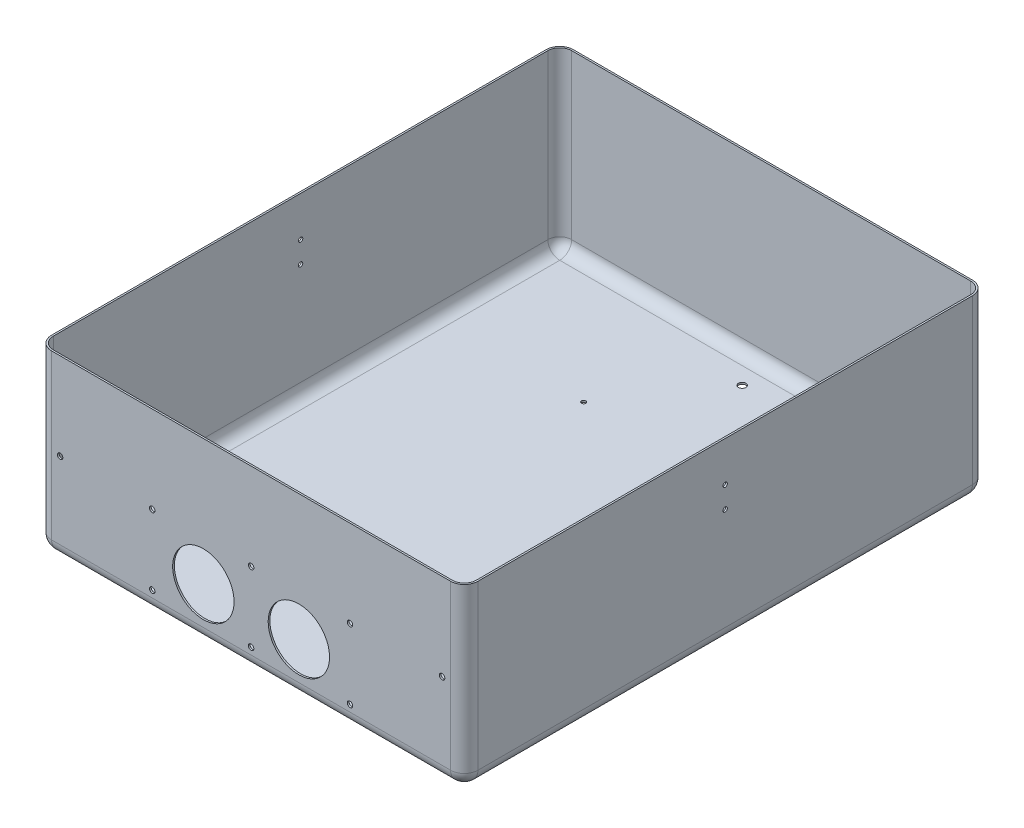
from build123d import *

# Parameters (mm, degrees)
SKETCH1_W          = 396.875
SKETCH1_H          = 485.775
EXTRUDE1_DEPTH     = 165.1
FILLET1_R          = 12.7
FILLET2_R          = 12.7
SHELL1_T           = -1.6002
SKETCH2_R          = 28.575
SKETCH2_R_2        = 2.5527
CUT_EXTRUDE1_DEPTH = 25.4
SKETCH6_R          = 3.4544
CUT_EXTRUDE5_DEPTH = 551.102537743
SKETCH7_R          = 1.9812
CUT_EXTRUDE6_DEPTH = 551.102537743
CUT_EXTRUDE7_REACH = 650.649
SKETCH8_R          = 2.0447


with BuildPart() as part:
    # Sketch1 → Extrude1 (new body)
    with BuildSketch(Plane(origin=(0, 0, 0), x_dir=(1, 0, 0), z_dir=(0, 1, 0))):
        with Locations((0, 242.8875)):
            Rectangle(SKETCH1_W, SKETCH1_H)
    extrude(amount=EXTRUDE1_DEPTH)

    # Fillet1
    fillet1_edges = [part.edges().sort_by_distance(p)[0] for p in [
        (-198.4375, 82.55, -485.775),
        (198.4375, 82.55, -485.775),
        (198.4375, 82.55, 0),
        (-198.4375, 82.55, 0),
    ]]
    fillet(fillet1_edges, radius=FILLET1_R)

    # Fillet2
    fillet2_edges = [part.edges().sort_by_distance(p)[0] for p in [
        (0, 0, 0),
        (-198.4375, 0, -242.8875),
        (0, 0, -485.775),
        (198.4375, 0, -242.8875),
        (194.717756121, 0, -3.719743879),
        (194.717756121, 0, -482.055256121),
        (-194.717756121, 0, -482.055256121),
        (-194.717756121, 0, -3.719743879),
    ]]
    fillet(fillet2_edges, radius=FILLET2_R)

    # Shell1
    shell1_openings = [part.faces().sort_by_distance(p)[0] for p in [
        (0, 165.1, -242.8875),
    ]]
    offset(amount=SHELL1_T, openings=shell1_openings, kind=Kind.INTERSECTION)

    # Sketch2 → Cut-Extrude1 (cut)
    with BuildSketch(Plane.XY):
        with Locations((-44.45, 47.625)):
            Circle(SKETCH2_R)
        with Locations(Location((44.45, 47.625, 0), (0, 0, 180))):
            Circle(SKETCH2_R)
        with Locations((-92.075, 84.1502)):
            Circle(SKETCH2_R_2)
        with Locations((-92.075, 19.05)):
            Circle(SKETCH2_R_2)
        with Locations(Location((92.075, 19.05, 0), (0, 0, 180))):
            Circle(SKETCH2_R_2)
        with Locations(Location((92.075, 84.1502, 0), (0, 0, 180))):
            Circle(SKETCH2_R_2)
        with Locations((0, 84.1502)):
            Circle(SKETCH2_R_2)
        with Locations((0, 19.05)):
            Circle(SKETCH2_R_2)
        with Locations((-177.8, 84.1502)):
            Circle(SKETCH2_R_2)
        with Locations(Location((177.8, 84.1502, 0), (0, 0, 180))):
            Circle(SKETCH2_R_2)
    extrude(amount=-CUT_EXTRUDE1_DEPTH, mode=Mode.SUBTRACT)

    # Sketch6 → Cut-Extrude5 (cut, through all)
    with BuildSketch(Plane(origin=(0, 0, 0), x_dir=(1, 0, 0), z_dir=(0, 1, 0))):
        with Locations(Location((0, 457.2, 0), (0, 0, 270))):
            Circle(SKETCH6_R)
    extrude(amount=CUT_EXTRUDE5_DEPTH, mode=Mode.SUBTRACT)

    # Sketch7 → Cut-Extrude6 (cut, through all)
    with BuildSketch(Plane(origin=(0, 0, 0), x_dir=(1, 0, 0), z_dir=(0, 1, 0))):
        with Locations(Location((-60.325, 103.2002, 0), (0, 0, 270))):
            Circle(SKETCH7_R)
        with Locations(Location((-60.325, 369.8748, 0), (0, 0, 270))):
            Circle(SKETCH7_R)
        with Locations(Location((60.325, 369.8748, 0), (0, 0, 90))):
            Circle(SKETCH7_R)
        with Locations(Location((60.325, 103.2002, 0), (0, 0, 90))):
            Circle(SKETCH7_R)
    extrude(amount=CUT_EXTRUDE6_DEPTH, mode=Mode.SUBTRACT)

    # Sketch8 → Cut-Extrude7 (cut, up to next)
    with BuildSketch(Plane(origin=(198.4375, 0, 0), x_dir=(0, 0, -1), z_dir=(1, 0, 0)), mode=Mode.PRIVATE) as cut_extrude7_sk1:
        with Locations((242.8875, 127.762)):
            Circle(SKETCH8_R)
    cut_extrude7_tool1 = extrude(cut_extrude7_sk1.sketch, amount=-CUT_EXTRUDE7_REACH, mode=Mode.PRIVATE) & part.part
    # Sketch8 → Cut-Extrude7 (cut, up to next)
    with BuildSketch(Plane(origin=(198.4375, 0, 0), x_dir=(0, 0, -1), z_dir=(1, 0, 0)), mode=Mode.PRIVATE) as cut_extrude7_sk2:
        with Locations((242.8875, 107.8484)):
            Circle(SKETCH8_R)
    cut_extrude7_tool2 = extrude(cut_extrude7_sk2.sketch, amount=-CUT_EXTRUDE7_REACH, mode=Mode.PRIVATE) & part.part
    cut_extrude7_1 = cut_extrude7_tool1.solids().sort_by_distance((198.4375, 127.762, -242.8875))[0]
    add(cut_extrude7_1, mode=Mode.SUBTRACT)
    cut_extrude7_2 = cut_extrude7_tool2.solids().sort_by_distance((198.4375, 107.8484, -242.8875))[0]
    add(cut_extrude7_2, mode=Mode.SUBTRACT)
    cut_extrude7 = cut_extrude7_1 + cut_extrude7_2  # Cut-Extrude7 as one shape, for the pattern or mirror that repeats it

    # Mirror1: Cut-Extrude7 across plane
    add(cut_extrude7.mirror(Plane(origin=(0, 0, 0), x_dir=(0, 0, 1), z_dir=(1, 0, 0))), mode=Mode.SUBTRACT)


solid = part.part
